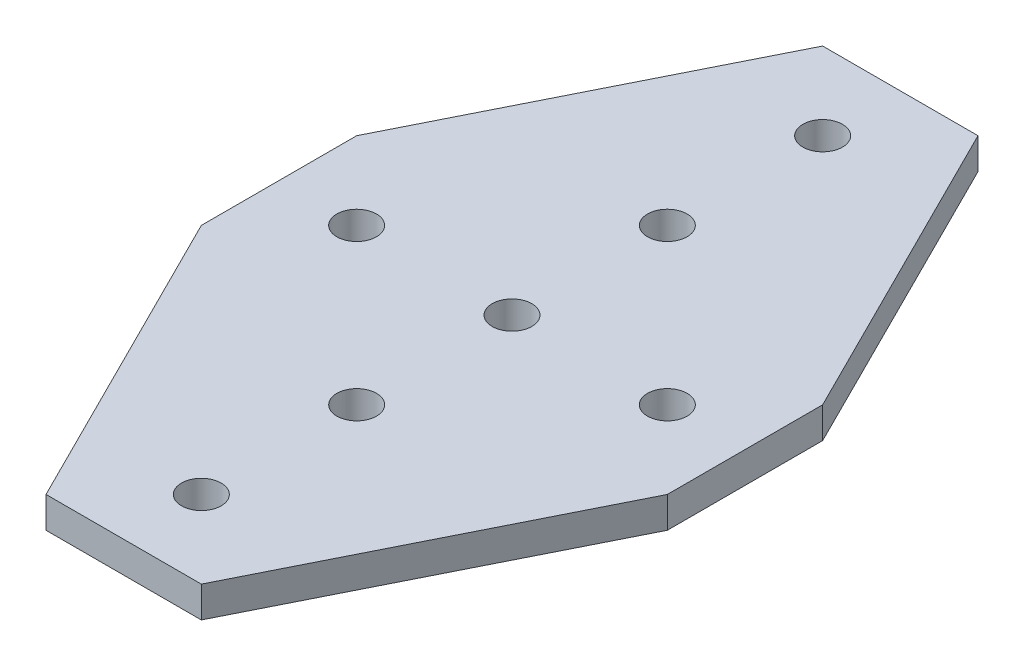
from build123d import *

# Parameters (mm, degrees)
SKETCH1_R           = 2.55
BOSS_EXTRUDE1_DEPTH = 4


with BuildPart() as part:
    # Sketch1 → Boss-Extrude1 (new body)
    with BuildSketch(Plane(origin=(0, 0, 0), x_dir=(1, 0, 0), z_dir=(0, 1, 0))):
        Polygon((30, -10), (10, -50), (-10, -50), (-30, -10), (-30, 10), (-10, 50), (10, 50), (30, 10), align=None)
        with Locations(Location((0, 20, 0), (0, 0, 270))):
            Circle(SKETCH1_R, mode=Mode.SUBTRACT)
        with Locations(Location((0, 40, 0), (0, 0, 270))):
            Circle(SKETCH1_R, mode=Mode.SUBTRACT)
        with Locations(Location((0, 0, 0), (0, 0, 270))):
            Circle(SKETCH1_R, mode=Mode.SUBTRACT)
        with Locations(Location((0, -20, 0), (0, 0, 90))):
            Circle(SKETCH1_R, mode=Mode.SUBTRACT)
        with Locations(Location((0, -40, 0), (0, 0, 90))):
            Circle(SKETCH1_R, mode=Mode.SUBTRACT)
        with Locations(Location((-20, 0, 0), (0, 0, 270))):
            Circle(SKETCH1_R, mode=Mode.SUBTRACT)
        with Locations(Location((20, 0, 0), (0, 0, 90))):
            Circle(SKETCH1_R, mode=Mode.SUBTRACT)
    extrude(amount=BOSS_EXTRUDE1_DEPTH)


solid = part.part
